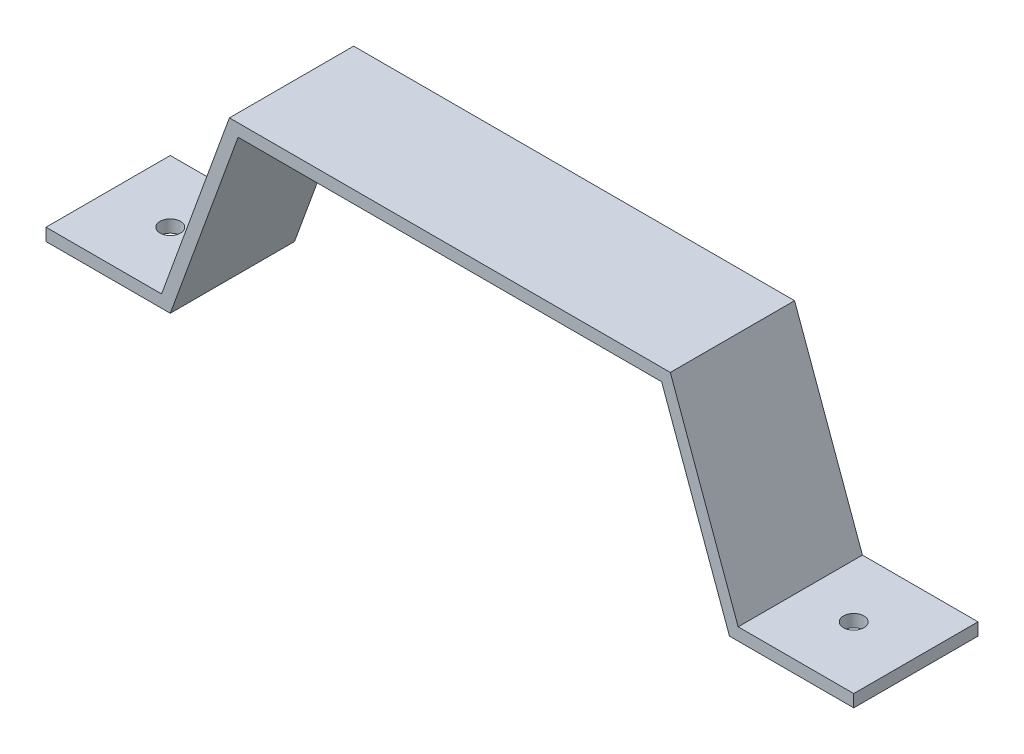
from build123d import *

# Parameters (mm, degrees)
EXTRUDE_1_DEPTH     = 20
SKETCH_2_R          = 1.645091665
CUT_EXTRUDE_1_DEPTH = 20


with BuildPart() as part:
    # 草图1 → 凸台-拉伸1 (new body)
    with BuildSketch(Plane.XY):
        Polygon((-71.352101151, 0), (-51.352101151, 0), (-40.432994123, 30), (27.728791821, 30), (38.647898849, 0), (58.647898849, 0), (58.647898849, 2), (40.048313925, 2), (29.129206897, 32), (-41.8334092, 32), (-52.752516228, 2), (-71.352101151, 2), align=None)
    extrude(amount=EXTRUDE_1_DEPTH)

    # 草图2 → 切除-拉伸1 (cut)
    with BuildSketch(Plane(origin=(0, 0, 0), x_dir=(1, 0, 0), z_dir=(0, 1, 0))):
        with Locations((-61.352101151, -10)):
            Circle(SKETCH_2_R)
        with Locations(Location((48.647898849, -10, 0), (0, 0, 90))):
            Circle(SKETCH_2_R)
    extrude(amount=CUT_EXTRUDE_1_DEPTH, mode=Mode.SUBTRACT)


solid = part.part
